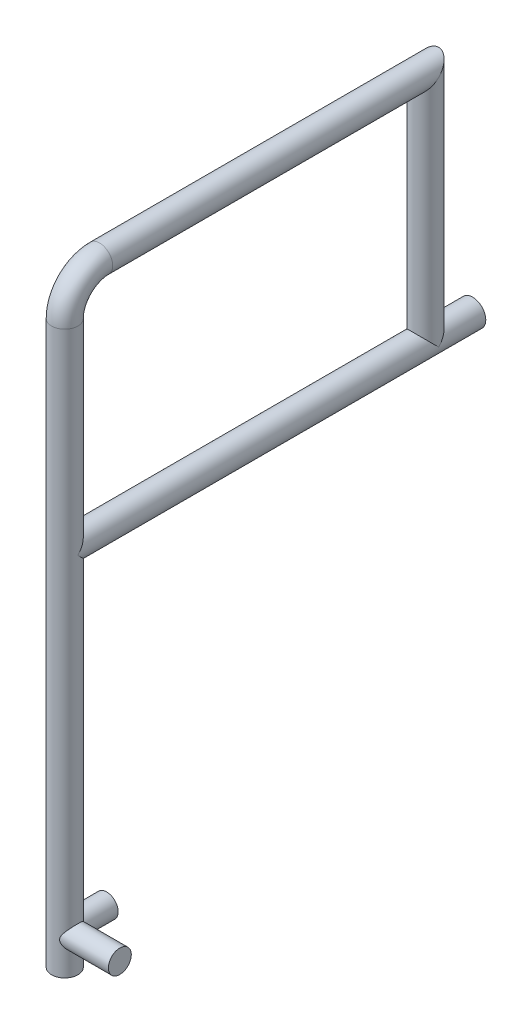
from build123d import *

# Parameters (mm, degrees)
SKETCH2_R           = 20
SKETCH5_R           = 20
BOSS_EXTRUDE1_DEPTH = 553.90605298
SKETCH6_R           = 20
BOSS_EXTRUDE2_DEPTH = 622
SKETCH7_R           = 17.5
CUT_EXTRUDE1_DEPTH  = 286
SKETCH8_R           = 17.5
BOSS_EXTRUDE4_DEPTH = 64
SKETCH11_R          = 17.5
BOSS_EXTRUDE5_DEPTH = 84


with BuildPart() as part:
    # Sweep1: sweep along a path in Sketch3
    with BuildLine(Plane(origin=(0, 0, 0), x_dir=(0, 0, -1), z_dir=(1, 0, 0))) as sweep1_path:
        Line((0, 0), (0, 302.819820908))
        ThreePointArc((0, 302.819820908), (15.565663847, 340.398657675), (53.144500614, 355.964321522))
        Line((53.144500614, 355.964321522), (550.094321522, 355.964321522))
        Line((550.094321522, 355.964321522), (550.094321522, 0.094321522))
    # Sketch2 → Sweep1 (sweep)
    with BuildSketch(Plane(origin=(0, 0, 0), x_dir=(1, 0, 0), z_dir=(0, 1, 0))):
        Circle(SKETCH2_R)
    sweep(path=sweep1_path.line, transition=Transition.RIGHT)

    # Sketch5 → Boss-Extrude1 (add)
    with BuildSketch(Plane.XZ):
        with Locations(Location((0, 0, 0), (0, 0, 90))):
            Circle(SKETCH5_R)
    extrude(amount=BOSS_EXTRUDE1_DEPTH)

    # Sketch6 → Boss-Extrude2 (add)
    with BuildSketch(Plane.XY):
        Circle(SKETCH6_R)
    extrude(amount=-BOSS_EXTRUDE2_DEPTH)

    # Sketch7 → Cut-Extrude1 (cut)
    with BuildSketch(Plane(origin=(0, 0, -622), x_dir=(-1, 0, 0), z_dir=(0, 0, -1))):
        Circle(SKETCH7_R)
    extrude(amount=-CUT_EXTRUDE1_DEPTH, mode=Mode.SUBTRACT)

    # Sketch8 → Boss-Extrude4 (add)
    with BuildSketch(Plane.XY):
        with Locations((0, -503.90605298)):
            Circle(SKETCH8_R)
    extrude(amount=-BOSS_EXTRUDE4_DEPTH)

    # Sketch11 → Boss-Extrude5 (add)
    with BuildSketch(Plane(origin=(0, 0, 0), x_dir=(0, 0, -1), z_dir=(1, 0, 0))):
        with Locations((0, -503.90605298)):
            Circle(SKETCH11_R)
    extrude(amount=BOSS_EXTRUDE5_DEPTH)


solid = part.part
